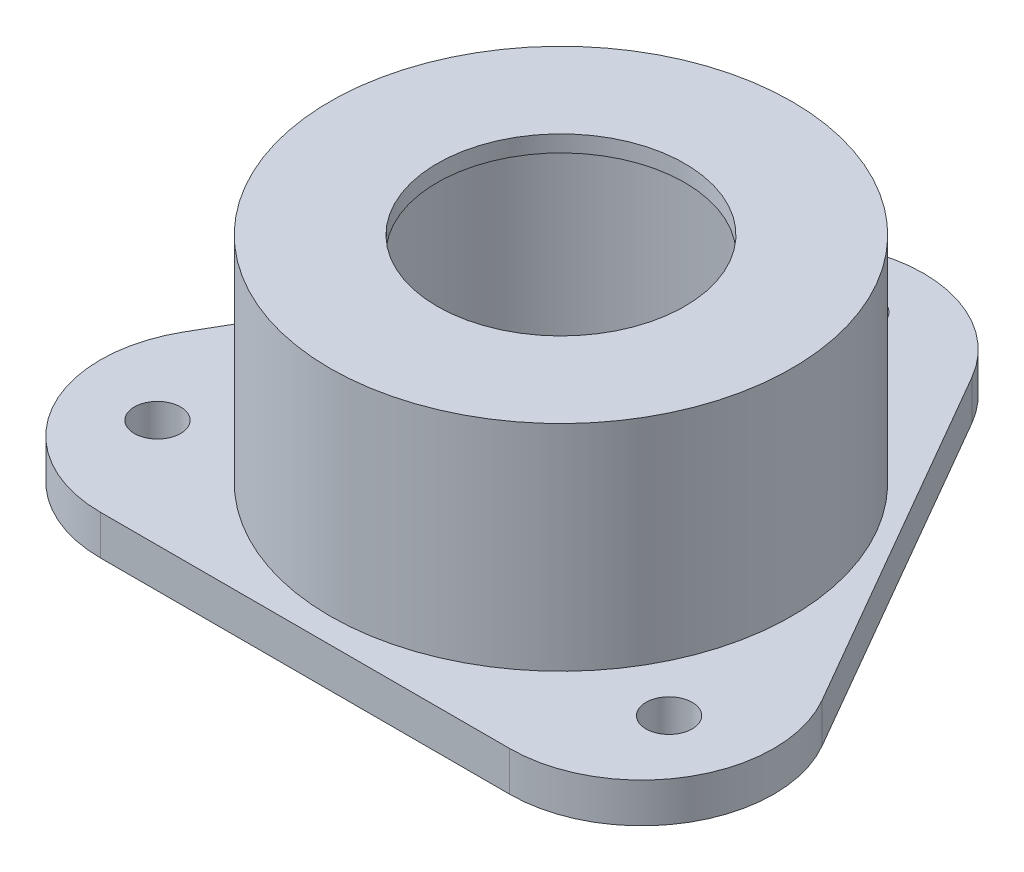
from build123d import *

# Parameters (mm, degrees)
BOSS_EXTRUDE1_DEPTH = 12
SKETCH2_R           = 37.5
CUT_EXTRUDE1_DEPTH  = 22
SKETCH5_R           = 7
CUT_EXTRUDE3_DEPTH  = 22
SKETCH6_R           = 70
BOSS_EXTRUDE2_DEPTH = 65
CUT_EXTRUDE4_START  = -80
SKETCH7_R           = 37.5
CUT_EXTRUDE4_DEPTH  = 80
SKETCH9_R           = 55
CUT_EXTRUDE5_DEPTH  = 72


with BuildPart() as part:
    # Sketch1 → Boss-Extrude1 (new body)
    with BuildSketch(Plane(origin=(0, 0, 0), x_dir=(1, 0, 0), z_dir=(0, 1, 0))):
        with BuildLine():
            Line((66.645984298, 85.104941493), (128.643951995, -22.278688525))
            ThreePointArc((128.643951995, -22.278688525), (128.643951995, -62.278688525), (94.002935844, -82.278688525))
            Line((94.002935844, -82.278688525), (-29.992999551, -82.278688525))
            ThreePointArc((-29.992999551, -82.278688525), (-64.634015702, -62.278688525), (-64.634015702, -22.278688525))
            Line((-64.634015702, -22.278688525), (-2.636048005, 85.104941493))
            ThreePointArc((-2.636048005, 85.104941493), (32.004968146, 105.104941493), (66.645984298, 85.104941493))
        make_face()
    extrude(amount=BOSS_EXTRUDE1_DEPTH)

    # Sketch2 → Cut-Extrude1 (cut)
    with BuildSketch(Plane(origin=(0, 12, 0), x_dir=(1, 0, 0), z_dir=(0, 1, 0))):
        with Locations(Location((32.004968146, -4.752094378, 0), (0, 0, 270))):
            Circle(SKETCH2_R)
    extrude(amount=-CUT_EXTRUDE1_DEPTH, mode=Mode.SUBTRACT)

    # Sketch5 → Cut-Extrude3 (cut)
    with BuildSketch(Plane(origin=(0, 12, 0), x_dir=(1, 0, 0), z_dir=(0, 1, 0))):
        with Locations(Location((109.504968146, -49.49674024, 0), (0, 0, 270))):
            Circle(SKETCH5_R)
        with Locations(Location((32.004968146, 84.737197347, 0), (0, 0, 270))):
            Circle(SKETCH5_R)
        with Locations(Location((-45.495031854, -49.49674024, 0), (0, 0, 270))):
            Circle(SKETCH5_R)
    extrude(amount=-CUT_EXTRUDE3_DEPTH, mode=Mode.SUBTRACT)

    # Sketch6 → Boss-Extrude2 (add)
    with BuildSketch(Plane(origin=(0, 12, 0), x_dir=(1, 0, 0), z_dir=(0, 1, 0))):
        with Locations(Location((32.004968146, -4.752094378, 0), (0, 0, 270))):
            Circle(SKETCH6_R)
    extrude(amount=BOSS_EXTRUDE2_DEPTH)

    # Sketch7 → Cut-Extrude4 (cut)
    with BuildSketch(Plane(origin=(0, 12, 0), x_dir=(-1, 0, 0), z_dir=(0, -1, 0)).offset(CUT_EXTRUDE4_START)):
        with Locations(Location((-32.004968146, -4.752094378, 0), (0, 0, 270))):
            Circle(SKETCH7_R)
    extrude(amount=CUT_EXTRUDE4_DEPTH, mode=Mode.SUBTRACT)

    # Sketch9 → Cut-Extrude5 (cut)
    with BuildSketch(Plane(origin=(0, 0, 0), x_dir=(-1, 0, 0), z_dir=(0, -1, 0))):
        with Locations(Location((-32.004968146, -4.752094378, 0), (0, 0, 90))):
            Circle(SKETCH9_R)
    extrude(amount=-CUT_EXTRUDE5_DEPTH, mode=Mode.SUBTRACT)


solid = part.part
